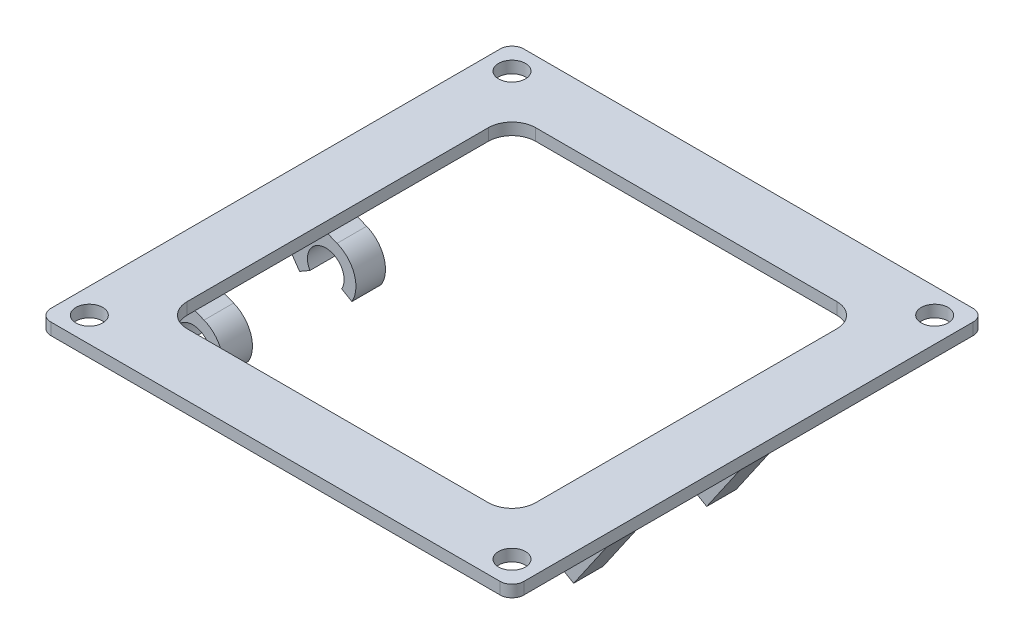
from build123d import *

# Parameters (mm, degrees)
SKETCH1_W               = 80
SKETCH1_H               = 57.5
BOSS_EXTRUDE1_DEPTH     = 8
BOSS_EXTRUDE2_START     = -10
SKETCH3_R               = 3.1
BOSS_EXTRUDE2_DEPTH     = 5
CUT_EXTRUDE1_DEPTH      = 10
CUT_EXTRUDE1_DEPTH_BACK = 63
MOVE_FACE1_BY           = 6
SKETCH5_W               = 80
SKETCH5_H               = 79.999909439
BOSS_EXTRUDE3_DEPTH     = 2
FILLET1_R               = 2
SKETCH6_R               = 2.275
CUT_EXTRUDE2_DEPTH      = 2
SKETCH7_W               = 58.936081431
SKETCH7_H               = 58.936081431
CUT_EXTRUDE3_DEPTH      = 2
FILLET2_R               = 4


with BuildPart() as part:
    # Sketch1 → Boss-Extrude1 (new body)
    with BuildSketch(Plane(origin=(0, 1.4, 0), x_dir=(1, 0, 0), z_dir=(0, 1, 0))):
        with Locations((0, 12.22)):
            Rectangle(SKETCH1_W, SKETCH1_H)
    extrude(amount=BOSS_EXTRUDE1_DEPTH)

    # Sketch3 → Boss-Extrude2 (add)
    # profile 1 of 2: a face of its own
    with BuildSketch(Plane(origin=(0, 0, -36.97), x_dir=(-1, 0, 0), z_dir=(0, 0, -1)).offset(BOSS_EXTRUDE2_START)):
        with BuildLine():
            Line((-30, 1.4), (-40, 1.4))
            Line((-40, 1.4), (-34.195661174, -6.999383953))
            ThreePointArc((-34.195661174, -6.999383953), (-26.018142719, -7.286661669), (-28.090628592, 0.629090909))
            Line((-28.090628592, 0.629090909), (-30, 1.4))
        make_face()
        with Locations((-30, -4.1)):
            Circle(SKETCH3_R, mode=Mode.SUBTRACT)
    # profile 2 of 2: a face of its own
    with BuildSketch(Plane(origin=(0, 0, -36.97), x_dir=(-1, 0, 0), z_dir=(0, 0, -1)).offset(BOSS_EXTRUDE2_START)):
        with BuildLine():
            Line((34.195661174, -6.999383953), (40, 1.4))
            Line((40, 1.4), (30, 1.4))
            Line((30, 1.4), (28.090628592, 0.629090909))
            ThreePointArc((28.090628592, 0.629090909), (26.018142719, -7.286661669), (34.195661174, -6.999383953))
        make_face()
        with Locations((30, -4.1)):
            Circle(SKETCH3_R, mode=Mode.SUBTRACT)
    boss_extrude2 = extrude(amount=-BOSS_EXTRUDE2_DEPTH)

    # Mirror1: Boss-Extrude2 across plane
    add(boss_extrude2.mirror(Plane.XY.offset(-13.22)))

    # Sketch4 → Cut-Extrude1 (cut, two sides: drawn at the far end of the back side and taken through both)
    with BuildSketch(Plane(origin=(0, 0, -21.97), x_dir=(-1, 0, 0), z_dir=(0, 0, -1)).offset(-CUT_EXTRUDE1_DEPTH_BACK)):
        Polygon((-30, -4.1), (-20, -9.873502692), (-40, -9.873502692), align=None)
        Polygon((20, -9.873502692), (40, -9.873502692), (30, -4.1), align=None)
    extrude(amount=CUT_EXTRUDE1_DEPTH + CUT_EXTRUDE1_DEPTH_BACK, mode=Mode.SUBTRACT)

    # Move Face1: a face moved inward by 6.0
    extrude(part.faces().sort_by_distance((0, 9.4, -12.22))[0], amount=MOVE_FACE1_BY, dir=(0, -1, 0), mode=Mode.SUBTRACT)

    # Sketch5 → Boss-Extrude3 (add)
    with BuildSketch(Plane(origin=(0, 3.4, 0), x_dir=(1, 0, 0), z_dir=(0, 1, 0))):
        with Locations((0, 23.46995472)):
            Rectangle(SKETCH5_W, SKETCH5_H)
    extrude(amount=-BOSS_EXTRUDE3_DEPTH)

    # Fillet1
    fillet1_edges = [part.edges().sort_by_distance(p)[0] for p in [
        (-40, 2.4, 16.53),
        (40, 2.4, 16.53),
        (-40, 2.4, -63.469909439),
        (40, 2.4, -63.469909439),
    ]]
    fillet(fillet1_edges, radius=FILLET1_R)

    # Sketch6 → Cut-Extrude2 (cut)
    with BuildSketch(Plane(origin=(0, 3.4, 0), x_dir=(1, 0, 0), z_dir=(0, 1, 0))):
        with Locations((35.75, 59.219909439)):
            Circle(SKETCH6_R)
        with Locations((35.75, -12.280045281)):
            Circle(SKETCH6_R)
        with Locations((-35.74995472, 59.219909439)):
            Circle(SKETCH6_R)
        with Locations((-35.74995472, -12.280045281)):
            Circle(SKETCH6_R)
    extrude(amount=-CUT_EXTRUDE2_DEPTH, mode=Mode.SUBTRACT)

    # Sketch7 → Cut-Extrude3 (cut)
    with BuildSketch(Plane(origin=(0, 3.4, 0), x_dir=(1, 0, 0), z_dir=(0, 1, 0))):
        with Locations((2.264e-05, 23.469932079)):
            Rectangle(SKETCH7_W, SKETCH7_H)
    extrude(amount=-CUT_EXTRUDE3_DEPTH, mode=Mode.SUBTRACT)

    # Fillet2
    fillet2_edges = [part.edges().sort_by_distance(p)[0] for p in [
        (29.468063356, 2.4, -52.937972794),
        (29.468063356, 2.4, 5.998108637),
        (-29.468018075, 2.4, 5.998108637),
        (-29.468018075, 2.4, -52.937972794),
    ]]
    fillet(fillet2_edges, radius=FILLET2_R)


solid = part.part
